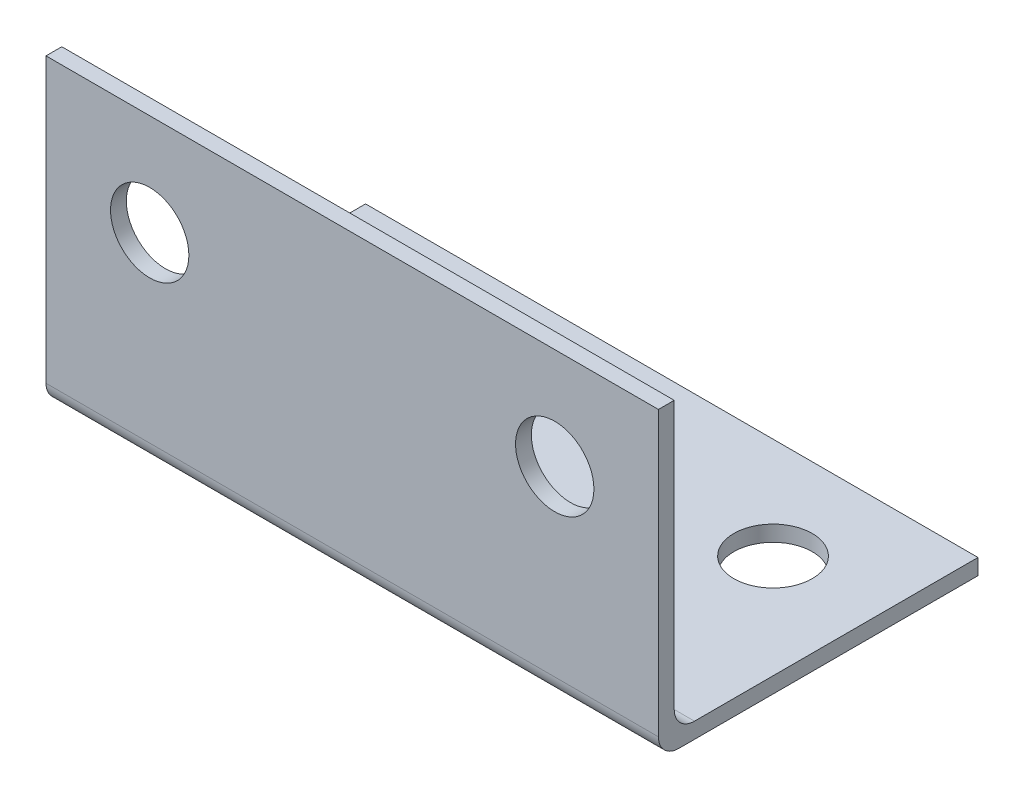
from build123d import *

# Parameters (mm, degrees)
SKETCH1_W                    = 38.4048
SKETCH1_H                    = 19.05
BOSS_EXTRUDE1_DEPTH          = 0.9906
F_10_0_1935_DIAMETER_HOLE1_D = 4.9149
SKETCH5_W                    = 38.4048
SKETCH5_H                    = 0.9906
BOSS_EXTRUDE2_DEPTH          = 19.05
F_10_0_1935_DIAMETER_HOLE2_D = 4.9149
FILLET1_R                    = 1.27


with BuildPart() as part:
    # Sketch1 → Boss-Extrude1 (new body)
    with BuildSketch(Plane.XY):
        Rectangle(SKETCH1_W, SKETCH1_H)
    extrude(amount=BOSS_EXTRUDE1_DEPTH)

    # #10 (0.1935) Diameter Hole1 (through all)
    with Locations(Plane.XY.offset(0.9906)):
        with Locations((-12.7, 3.175), (12.7, 3.175)):
            Hole(F_10_0_1935_DIAMETER_HOLE1_D / 2)

    # Sketch5 → Boss-Extrude2 (add)
    with BuildSketch(Plane(origin=(0, 0, 0), x_dir=(-1, 0, 0), z_dir=(0, 0, -1))):
        with Locations((0, -9.0297)):
            Rectangle(SKETCH5_W, SKETCH5_H)
    extrude(amount=BOSS_EXTRUDE2_DEPTH)

    # #10 (0.1935) Diameter Hole2 (through all)
    with Locations(Plane(origin=(0, -8.5344, 0), x_dir=(1, 0, 0), z_dir=(0, 1, 0))):
        with Locations((-12.7, 12.7), (12.7, 12.7)):
            Hole(F_10_0_1935_DIAMETER_HOLE2_D / 2)

    # Fillet1
    fillet1_edges = [part.edges().sort_by_distance(p)[0] for p in [
        (0, -8.5344, 0),
        (0, -9.525, 0.9906),
    ]]
    fillet(fillet1_edges, radius=FILLET1_R)


solid = part.part
